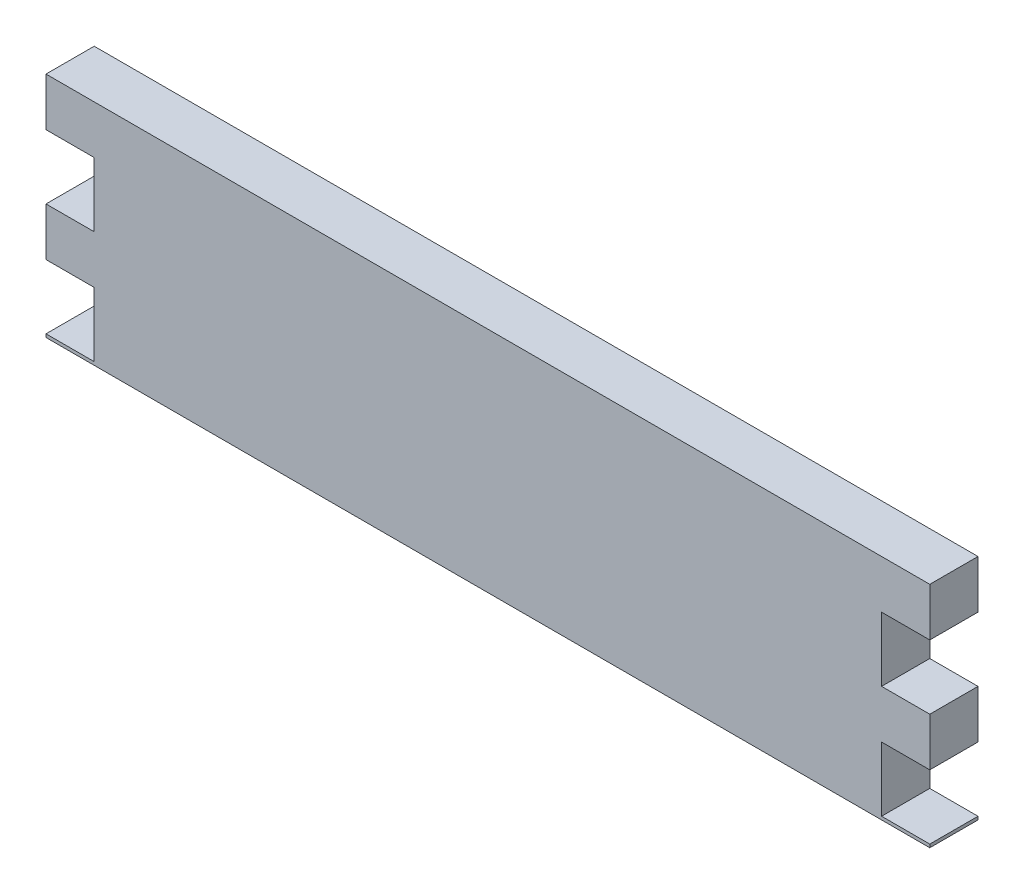
from build123d import *

# Parameters (mm, degrees)
SKETCH1_W           = 55
SKETCH1_H           = 14.2
BOSS_EXTRUDE1_DEPTH = 3
SKETCH3_W           = 3
SKETCH3_H           = 4
CUT_EXTRUDE1_DEPTH  = 10
SKETCH4_W           = 3
SKETCH4_H           = 4
CUT_EXTRUDE2_DEPTH  = 10


with BuildPart() as part:
    # Sketch1 → Boss-Extrude1 (new body)
    with BuildSketch(Plane.XY):
        Rectangle(SKETCH1_W, SKETCH1_H)
    extrude(amount=BOSS_EXTRUDE1_DEPTH)

    # Sketch3 → Cut-Extrude1 (cut)
    with BuildSketch(Plane.XY.offset(3)):
        with Locations((-26, 2.1)):
            Rectangle(SKETCH3_W, SKETCH3_H)
        with Locations((-26, -4.9)):
            Rectangle(SKETCH3_W, SKETCH3_H)
    extrude(amount=-CUT_EXTRUDE1_DEPTH, mode=Mode.SUBTRACT)

    # Sketch4 → Cut-Extrude2 (cut)
    with BuildSketch(Plane.XY.offset(3)):
        with Locations((26, 2.1)):
            Rectangle(SKETCH4_W, SKETCH4_H)
        with Locations((26, -4.9)):
            Rectangle(SKETCH4_W, SKETCH4_H)
    extrude(amount=-CUT_EXTRUDE2_DEPTH, mode=Mode.SUBTRACT)


solid = part.part
